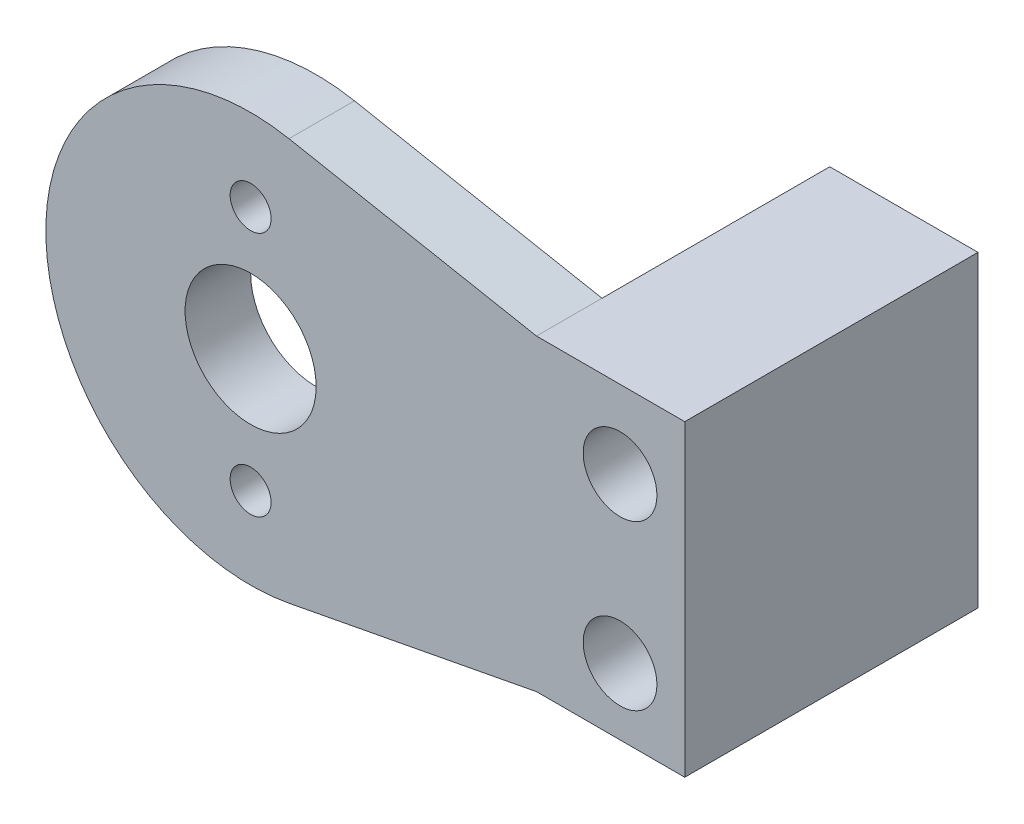
from build123d import *

# Parameters (mm, degrees)
BOSS_EXTRUDE1_DEPTH = 4.000000656
SKETCH2_W           = 9.05
SKETCH2_H           = 18.8
BOSS_EXTRUDE2_DEPTH = 13.9
SKETCH3_R           = 4
SKETCH3_R_2         = 2.25
SKETCH3_R_3         = 1.25
CUT_EXTRUDE1_DEPTH  = 30


with BuildPart() as part:
    # Sketch1 → Boss-Extrude1 (new body)
    with BuildSketch(Plane(origin=(0, 0, 79.940542579), x_dir=(-1, 0, 0), z_dir=(0, 0, -1))):
        with BuildLine():
            Line((9.05, 0), (24.160371291, -2.879093513))
            ThreePointArc((24.160371291, -2.879093513), (39, 9.4), (24.160371291, 21.679093513))
            Line((24.160371291, 21.679093513), (9.05, 18.8))
            Line((9.05, 18.8), (0, 18.8))
            Line((0, 18.8), (0, 0))
            Line((0, 0), (9.05, 0))
        make_face()
    extrude(amount=-BOSS_EXTRUDE1_DEPTH)

    # Sketch2 → Boss-Extrude2 (add)
    with BuildSketch(Plane(origin=(0, 0, 79.940542579), x_dir=(-1, 0, 0), z_dir=(0, 0, -1))):
        with Locations((4.525, 9.4)):
            Rectangle(SKETCH2_W, SKETCH2_H)
    extrude(amount=BOSS_EXTRUDE2_DEPTH)

    # Sketch3 → Cut-Extrude1 (cut)
    with BuildSketch(Plane.XY.offset(83.940543234)):
        with Locations((-26.5, 9.4)):
            Circle(SKETCH3_R)
        with Locations((-3.95, 14.05)):
            Circle(SKETCH3_R_2)
        with Locations((-3.95, 4.05)):
            Circle(SKETCH3_R_2)
        with Locations((-26.5, 16.9)):
            Circle(SKETCH3_R_3)
        with Locations((-26.5, 1.9)):
            Circle(SKETCH3_R_3)
    extrude(amount=-CUT_EXTRUDE1_DEPTH, mode=Mode.SUBTRACT)


solid = part.part
